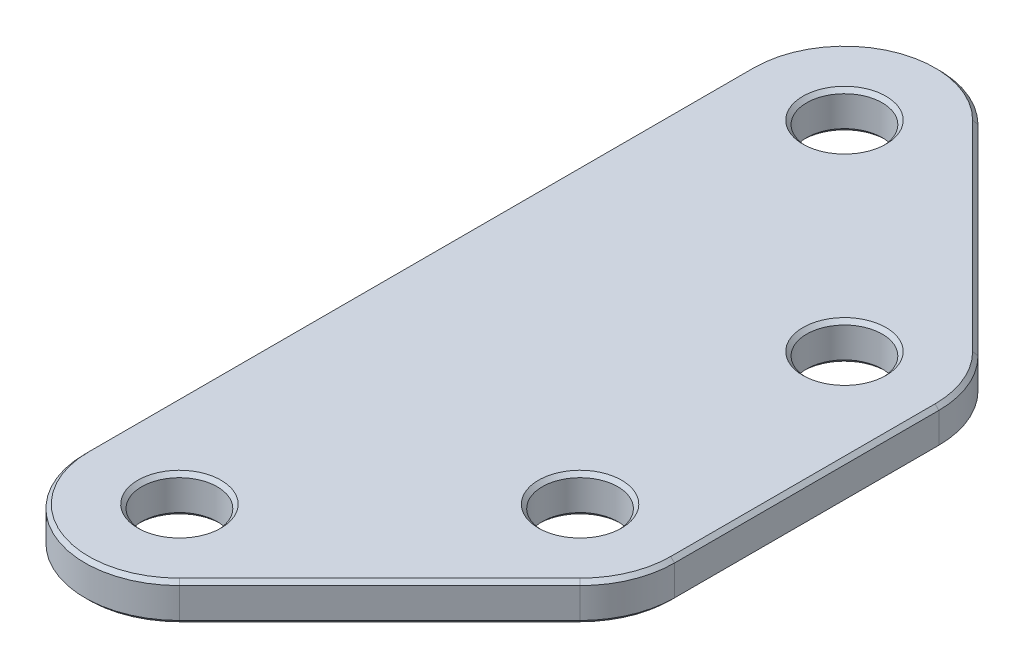
from build123d import *

# Parameters (mm, degrees)
SKETCH1_R           = 20
BOSS_EXTRUDE1_DEPTH = 20
CHAMFER1_SIZE       = 2


with BuildPart() as part:
    # Sketch1 → Boss-Extrude1 (new body)
    with BuildSketch(Plane(origin=(0, 0, 0), x_dir=(1, 0, 0), z_dir=(0, 1, 0))):
        with BuildLine():
            Line((-100, 176.066017178), (-100, -176.066017178))
            ThreePointArc((-100, -176.066017178), (-69.134171618, -222.259993804), (-14.644660941, -211.421356237))
            Line((-14.644660941, -211.421356237), (91.421356237, -105.355339059))
            ThreePointArc((91.421356237, -105.355339059), (102.259993804, -89.134171618), (106.066017178, -70))
            Line((106.066017178, -70), (106.066017178, 70))
            ThreePointArc((106.066017178, 70), (102.259993804, 89.134171618), (91.421356237, 105.355339059))
            Line((91.421356237, 105.355339059), (-14.644660941, 211.421356237))
            ThreePointArc((-14.644660941, 211.421356237), (-69.134171618, 222.259993804), (-100, 176.066017178))
        make_face()
        with Locations(Location((-50, 176.066017178, 0), (0, 0, 270))):
            Circle(SKETCH1_R, mode=Mode.SUBTRACT)
        with Locations(Location((56.066017178, 70, 0), (0, 0, 270))):
            Circle(SKETCH1_R, mode=Mode.SUBTRACT)
        with Locations(Location((56.066017178, -70, 0), (0, 0, 270))):
            Circle(SKETCH1_R, mode=Mode.SUBTRACT)
        with Locations(Location((-50, -176.066017178, 0), (0, 0, 270))):
            Circle(SKETCH1_R, mode=Mode.SUBTRACT)
    extrude(amount=BOSS_EXTRUDE1_DEPTH)

    # Chamfer1
    chamfer1_edges = [part.edges().sort_by_distance(p)[0] for p in [
        (106.066017178, 0, 0),
        (102.259993804, 0, 89.134171618),
        (38.388347648, 0, 158.388347648),
        (-69.134171618, 0, 222.259993804),
        (102.259993804, 20, 89.134171618),
        (106.066017178, 20, 0),
        (102.259993804, 20, -89.134171618),
        (-50, 0, -196.066017178),
        (-50, 20, -196.066017178),
        (38.388347648, 20, -158.388347648),
        (56.066017178, 0, -90),
        (56.066017178, 20, -90),
        (-69.134171618, 20, -222.259993804),
        (56.066017178, 0, 50),
        (56.066017178, 20, 50),
        (-100, 20, 0),
        (-50, 0, 156.066017178),
        (-50, 20, 156.066017178),
        (-69.134171618, 20, 222.259993804),
        (-100, 0, 0),
        (38.388347648, 20, 158.388347648),
        (-69.134171618, 0, -222.259993804),
        (38.388347648, 0, -158.388347648),
        (102.259993804, 0, -89.134171618),
    ]]
    chamfer(chamfer1_edges, length=CHAMFER1_SIZE)


solid = part.part
